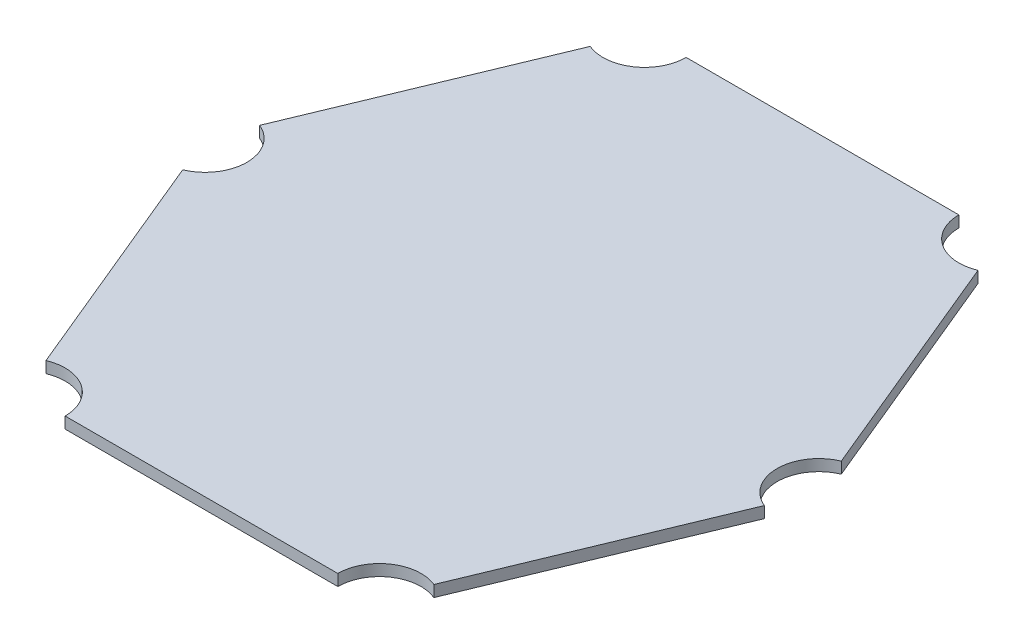
from build123d import *

# Parameters (mm, degrees)
EXTRUDE_1_DEPTH     = 3
SKETCH_5_R          = 11
CUT_EXTRUDE_2_DEPTH = 116.299609713


with BuildPart() as part:
    # 草图4 → 凸台-拉伸1 (new body)
    with BuildSketch(Plane(origin=(0, 0, 0), x_dir=(1, 0, 0), z_dir=(0, 1, 0))):
        Polygon((-47, 82), (47, 82), (81, 0), (47, -82), (-47, -82), (-81, 0), align=None)
    extrude(amount=EXTRUDE_1_DEPTH)

    # 草图5 → 切除-拉伸2 (cut, through all)
    with BuildSketch(Plane(origin=(0, 3, 0), x_dir=(1, 0, 0), z_dir=(0, 1, 0))):
        with Locations((-81, 0)):
            Circle(SKETCH_5_R)
        with Locations((81, 0)):
            Circle(SKETCH_5_R)
        with Locations((47, -82)):
            Circle(SKETCH_5_R)
        with Locations((-47, -82)):
            Circle(SKETCH_5_R)
        with Locations((-47, 82)):
            Circle(SKETCH_5_R)
        with Locations((47, 82)):
            Circle(SKETCH_5_R)
    extrude(amount=-CUT_EXTRUDE_2_DEPTH, mode=Mode.SUBTRACT)


solid = part.part
